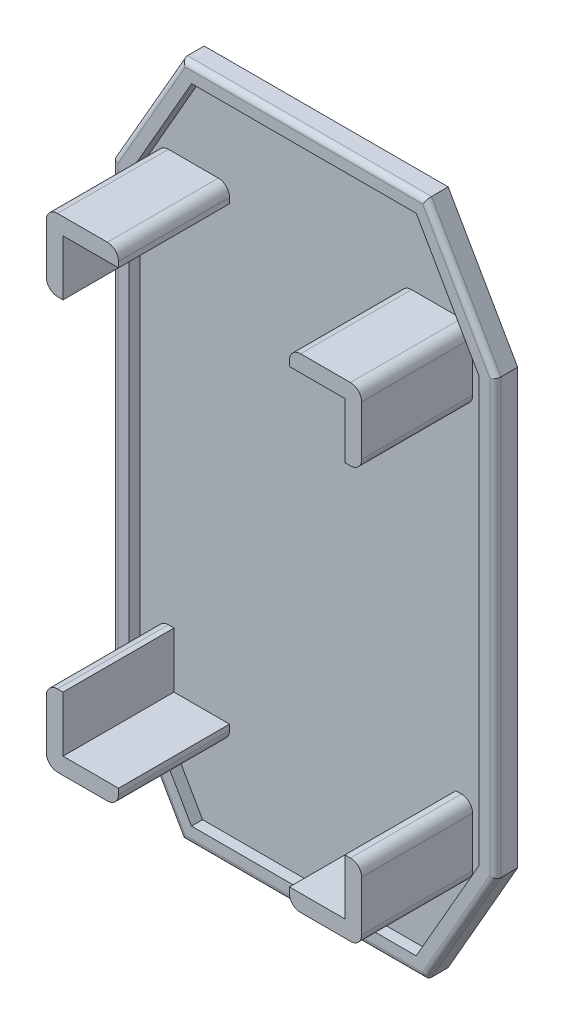
from build123d import *

# Parameters (mm, degrees)
BOSS_EXTRUDE1_DEPTH = 1
BOSS_EXTRUDE2_DEPTH = 1
BOSS_EXTRUDE3_DEPTH = 10
CUT_EXTRUDE1_DEPTH  = 6.35
FILLET1_R           = 1
FILLET2_R           = 0.5


with BuildPart() as part:
    # Sketch1 → Boss-Extrude1 (new body)
    with BuildSketch(Plane.XY):
        Polygon((-18.007564672, 19.736677749), (-18.007564672, -19.727423866), (-11.433074418, -31.219203109), (11.416925582, -31.219203109), (18.007564672, -19.736677749), (18.007564672, 19.727423866), (11.433074418, 31.219203109), (-11.416925582, 31.219203109), align=None)
    extrude(amount=BOSS_EXTRUDE1_DEPTH)

    # Sketch2 → Boss-Extrude2 (add)
    with BuildSketch(Plane.XY.offset(1)):
        Polygon((-10.982642952, 30.469203109), (-17.257564672, 19.536735589), (-17.257564672, -19.528046249), (-10.99808756, -30.469203109), (10.982642952, -30.469203109), (17.257564672, -19.536735589), (17.257564672, 19.528046249), (10.99808756, 30.469203109), align=None)
        Polygon((-10.114077691, 28.969203109), (-15.757564672, 19.136851269), (-15.757564672, -19.129291014), (-10.128113844, -28.969203109), (10.114077691, -28.969203109), (15.757564672, -19.136851269), (15.757564672, 19.129291014), (10.128113844, 28.969203109), align=None, mode=Mode.SUBTRACT)
    extrude(amount=BOSS_EXTRUDE2_DEPTH)

    # Sketch3 → Boss-Extrude3 (add)
    with BuildSketch(Plane.XY.offset(1)):
        Polygon((-14.2, -21.8), (-14.2, -15.3), (-12.7, -15.3), (-12.7, -20.3), (-7.7, -20.3), (-7.7, -21.8), align=None)
        Polygon((-12.7, 20.3), (-7.7, 20.3), (-7.7, 21.8), (-14.2, 21.8), (-14.2, 15.3), (-12.7, 15.3), align=None)
        Polygon((12.7, -20.3), (12.7, -15.3), (14.2, -15.3), (14.2, -21.8), (7.7, -21.8), (7.7, -20.3), align=None)
        Polygon((12.7, 15.3), (14.2, 15.3), (14.2, 21.8), (7.7, 21.8), (7.7, 20.3), (12.7, 20.3), align=None)
    extrude(amount=BOSS_EXTRUDE3_DEPTH)

    # Sketch4 → Cut-Extrude1 (cut)
    with BuildSketch(Plane.XY.offset(1)):
        Polygon((13.897999946, 35.469203109), (-13.877860488, 35.469203109), (-22.257564672, 20.869683322), (-22.257564672, -20.857230366), (-13.897999946, -35.469203109), (13.877860488, -35.469203109), (22.257564672, -20.869683322), (22.257564672, 20.857230366), align=None)
        Polygon((10.99808756, 30.469203109), (-10.982642952, 30.469203109), (-17.257564672, 19.536735589), (-17.257564672, -19.528046249), (-10.99808756, -30.469203109), (10.982642952, -30.469203109), (17.257564672, -19.536735589), (17.257564672, 19.528046249), align=None, mode=Mode.SUBTRACT)
    extrude(amount=-CUT_EXTRUDE1_DEPTH, mode=Mode.SUBTRACT)

    # Fillet1
    fillet1_edges = [part.edges().sort_by_distance(p)[0] for p in [
        (-7.7, 21.8, 6),
        (-14.2, 21.8, 6),
        (-14.2, 15.3, 6),
        (7.7, -21.8, 6),
        (14.2, -21.8, 6),
        (14.2, -15.3, 6),
        (14.2, 15.3, 6),
        (14.2, 21.8, 6),
        (7.7, 21.8, 6),
        (-14.2, -15.3, 6),
        (-14.2, -21.8, 6),
        (-7.7, -21.8, 6),
    ]]
    fillet(fillet1_edges, radius=FILLET1_R)

    # Fillet2
    fillet2_edges = [part.edges().sort_by_distance(p)[0] for p in [
        (0.007722304, 30.469203109, 2),
        (-14.120103812, 25.002969349, 2),
        (-17.257564672, 0.00434467, 2),
        (-14.127826116, -24.998624679, 2),
        (-0.007722304, -30.469203109, 2),
        (14.120103812, -25.002969349, 2),
        (17.257564672, -0.00434467, 2),
        (14.127826116, 24.998624679, 2),
    ]]
    fillet(fillet2_edges, radius=FILLET2_R)


solid = part.part
